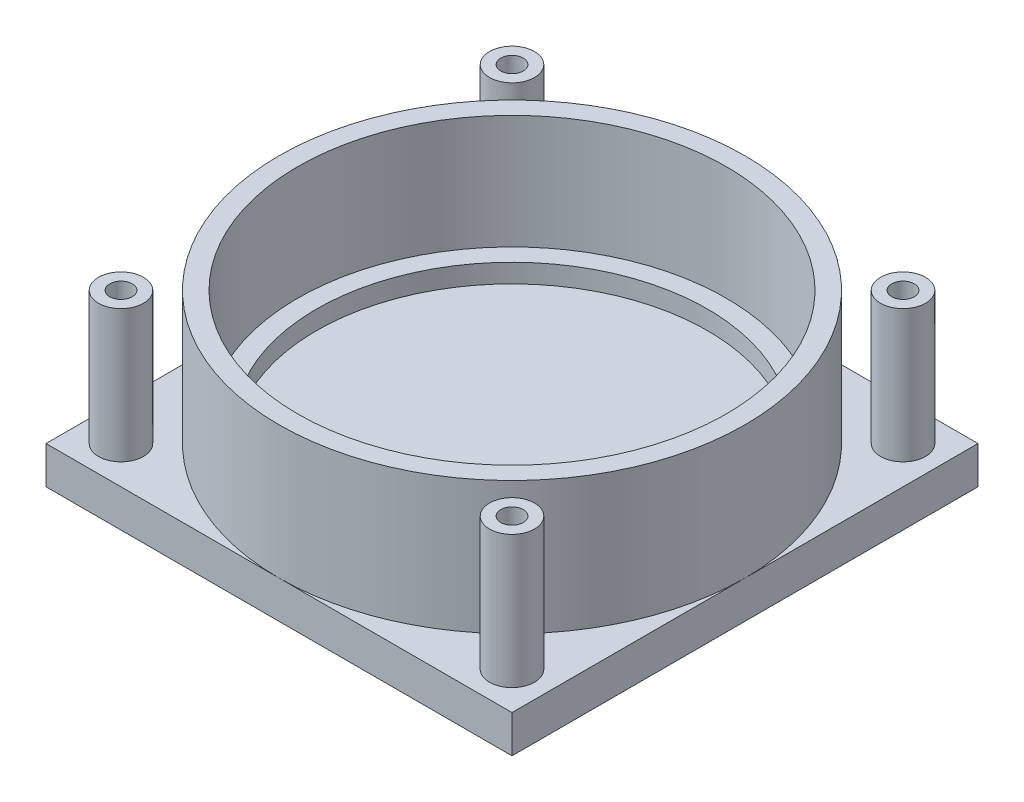
from build123d import *

# Parameters (mm, degrees)
SKETCH1_W           = 62.15
SKETCH1_H           = 62.15
BOSS_EXTRUDE1_DEPTH = 5
SKETCH3_R           = 31.075
BOSS_EXTRUDE2_DEPTH = 17.7
SKETCH4_R           = 28.575
CUT_EXTRUDE2_DEPTH  = 17.7
BOSS_EXTRUDE3_START = 2.5
SKETCH5_R           = 28.575
SKETCH5_R_2         = 26.075
BOSS_EXTRUDE3_DEPTH = 2.5
CUT_EXTRUDE4_REACH  = 49.377
SKETCH8_R           = 1.5
BOSS_EXTRUDE5_START = 17.7
SKETCH9_R           = 3
SKETCH9_R_2         = 1.5
BOSS_EXTRUDE5_DEPTH = 17.7


with BuildPart() as part:
    # Sketch1 → Boss-Extrude1 (new body)
    with BuildSketch(Plane(origin=(0, 0, 0), x_dir=(1, 0, 0), z_dir=(0, 1, 0))):
        Rectangle(SKETCH1_W, SKETCH1_H)
    extrude(amount=BOSS_EXTRUDE1_DEPTH)

    # Sketch3 → Boss-Extrude2 (add)
    with BuildSketch(Plane(origin=(0, 5, 0), x_dir=(1, 0, 0), z_dir=(0, 1, 0))):
        with Locations(Location((0, 0, 0), (0, 0, 270))):
            Circle(SKETCH3_R)
    extrude(amount=BOSS_EXTRUDE2_DEPTH)

    # Sketch4 → Cut-Extrude2 (cut)
    with BuildSketch(Plane(origin=(0, 22.7, 0), x_dir=(1, 0, 0), z_dir=(0, 1, 0))):
        with Locations(Location((0, 0, 0), (0, 0, 270))):
            Circle(SKETCH4_R)
    extrude(amount=-CUT_EXTRUDE2_DEPTH, mode=Mode.SUBTRACT)

    # Sketch5 → Boss-Extrude3 (add)
    with BuildSketch(Plane(origin=(0, 5, 0), x_dir=(1, 0, 0), z_dir=(0, 1, 0)).offset(BOSS_EXTRUDE3_START)):
        with Locations(Location((0, 0, 0), (0, 0, 270))):
            Circle(SKETCH5_R)
        with Locations(Location((0, 0, 0), (0, 0, 270))):
            Circle(SKETCH5_R_2, mode=Mode.SUBTRACT)
    extrude(amount=-BOSS_EXTRUDE3_DEPTH)

    # Sketch8 → Cut-Extrude4 (cut, up to next)
    with BuildSketch(Plane(origin=(0, 5, 0), x_dir=(1, 0, 0), z_dir=(0, 1, 0)), mode=Mode.PRIVATE) as cut_extrude4_sk1:
        with Locations(Location((-26.075, 26.075, 0), (0, 0, 270))):
            Circle(SKETCH8_R)
    cut_extrude4_tool1 = extrude(cut_extrude4_sk1.sketch, amount=-CUT_EXTRUDE4_REACH, mode=Mode.PRIVATE) & part.part
    # Sketch8 → Cut-Extrude4 (cut, up to next)
    with BuildSketch(Plane(origin=(0, 5, 0), x_dir=(1, 0, 0), z_dir=(0, 1, 0)), mode=Mode.PRIVATE) as cut_extrude4_sk2:
        with Locations(Location((-26.075, -26.075, 0), (0, 0, 270))):
            Circle(SKETCH8_R)
    cut_extrude4_tool2 = extrude(cut_extrude4_sk2.sketch, amount=-CUT_EXTRUDE4_REACH, mode=Mode.PRIVATE) & part.part
    # Sketch8 → Cut-Extrude4 (cut, up to next)
    with BuildSketch(Plane(origin=(0, 5, 0), x_dir=(1, 0, 0), z_dir=(0, 1, 0)), mode=Mode.PRIVATE) as cut_extrude4_sk3:
        with Locations(Location((26.075, -26.075, 0), (0, 0, 270))):
            Circle(SKETCH8_R)
    cut_extrude4_tool3 = extrude(cut_extrude4_sk3.sketch, amount=-CUT_EXTRUDE4_REACH, mode=Mode.PRIVATE) & part.part
    # Sketch8 → Cut-Extrude4 (cut, up to next)
    with BuildSketch(Plane(origin=(0, 5, 0), x_dir=(1, 0, 0), z_dir=(0, 1, 0)), mode=Mode.PRIVATE) as cut_extrude4_sk4:
        with Locations(Location((26.075, 26.075, 0), (0, 0, 270))):
            Circle(SKETCH8_R)
    cut_extrude4_tool4 = extrude(cut_extrude4_sk4.sketch, amount=-CUT_EXTRUDE4_REACH, mode=Mode.PRIVATE) & part.part
    add(cut_extrude4_tool1.solids().sort_by_distance((-26.075, 5, -26.075))[0], mode=Mode.SUBTRACT)
    add(cut_extrude4_tool2.solids().sort_by_distance((-26.075, 5, 26.075))[0], mode=Mode.SUBTRACT)
    add(cut_extrude4_tool3.solids().sort_by_distance((26.075, 5, 26.075))[0], mode=Mode.SUBTRACT)
    add(cut_extrude4_tool4.solids().sort_by_distance((26.075, 5, -26.075))[0], mode=Mode.SUBTRACT)

    # Sketch9 → Boss-Extrude5 (add)
    # profile 1 of 4: a face of its own
    with BuildSketch(Plane(origin=(0, 5, 0), x_dir=(1, 0, 0), z_dir=(0, 1, 0)).offset(BOSS_EXTRUDE5_START)):
        with Locations(Location((-26.075, 26.075, 0), (0, 0, 270))):
            Circle(SKETCH9_R)
        with Locations(Location((-26.075, 26.075, 0), (0, 0, 270))):
            Circle(SKETCH9_R_2, mode=Mode.SUBTRACT)
    # profile 2 of 4: a face of its own
    with BuildSketch(Plane(origin=(0, 5, 0), x_dir=(1, 0, 0), z_dir=(0, 1, 0)).offset(BOSS_EXTRUDE5_START)):
        with Locations(Location((-26.075, -26.075, 0), (0, 0, 90))):
            Circle(SKETCH9_R)
        with Locations(Location((-26.075, -26.075, 0), (0, 0, 270))):
            Circle(SKETCH9_R_2, mode=Mode.SUBTRACT)
    # profile 3 of 4: a face of its own
    with BuildSketch(Plane(origin=(0, 5, 0), x_dir=(1, 0, 0), z_dir=(0, 1, 0)).offset(BOSS_EXTRUDE5_START)):
        with Locations(Location((26.075, -26.075, 0), (0, 0, 270))):
            Circle(SKETCH9_R)
        with Locations(Location((26.075, -26.075, 0), (0, 0, 270))):
            Circle(SKETCH9_R_2, mode=Mode.SUBTRACT)
    # profile 4 of 4: a face of its own
    with BuildSketch(Plane(origin=(0, 5, 0), x_dir=(1, 0, 0), z_dir=(0, 1, 0)).offset(BOSS_EXTRUDE5_START)):
        with Locations(Location((26.075, 26.075, 0), (0, 0, 90))):
            Circle(SKETCH9_R)
        with Locations(Location((26.075, 26.075, 0), (0, 0, 270))):
            Circle(SKETCH9_R_2, mode=Mode.SUBTRACT)
    extrude(amount=-BOSS_EXTRUDE5_DEPTH)


solid = part.part
